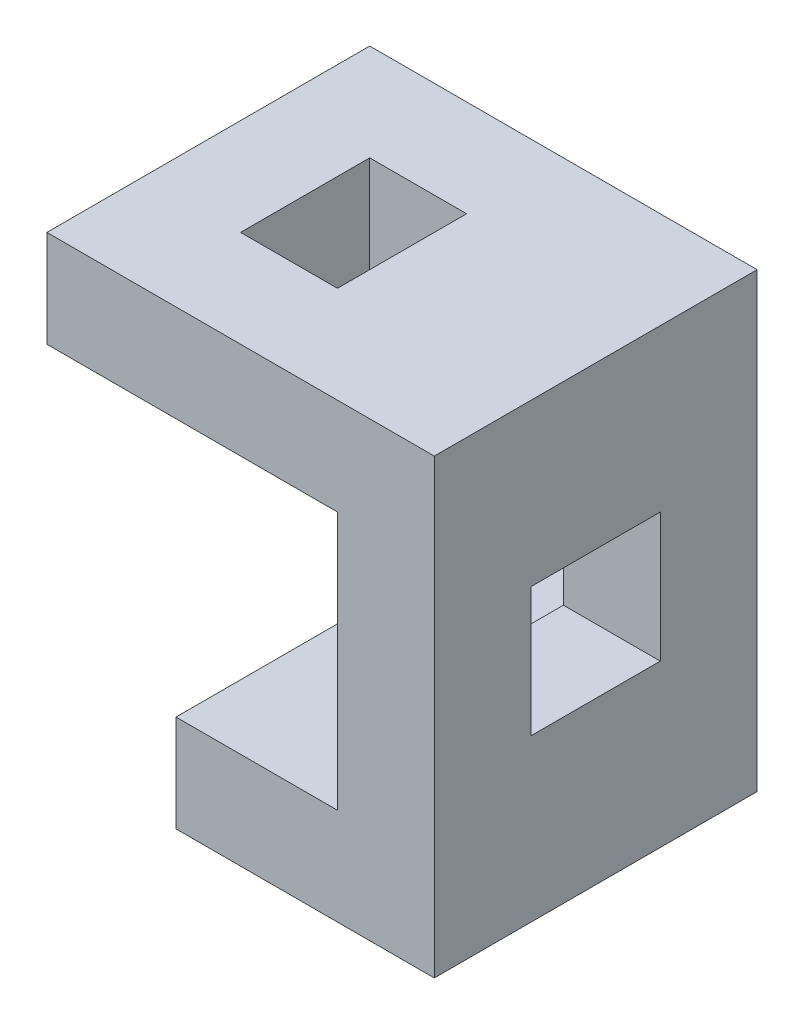
from build123d import *

# Parameters (mm, degrees)
BOSS_EXTRUDE1_DEPTH = 50
SKETCH2_W           = 20
SKETCH2_H           = 20
CUT_EXTRUDE1_DEPTH  = 50
SKETCH6_W           = 15
SKETCH6_H           = 20
CUT_EXTRUDE2_DEPTH  = 50


with BuildPart() as part:
    # Sketch1 → Boss-Extrude1 (new body)
    with BuildSketch(Plane.XY):
        Polygon((-60, 70), (0, 70), (0, 0), (-40, 0), (-40, 15), (-15, 15), (-15, 55), (-60, 55), align=None)
    extrude(amount=BOSS_EXTRUDE1_DEPTH)

    # Sketch2 → Cut-Extrude1 (cut)
    with BuildSketch(Plane(origin=(0, 0, 0), x_dir=(0, 0, -1), z_dir=(1, 0, 0))):
        with Locations((-25, 35)):
            Rectangle(SKETCH2_W, SKETCH2_H)
    extrude(amount=-CUT_EXTRUDE1_DEPTH, mode=Mode.SUBTRACT)

    # Sketch6 → Cut-Extrude2 (cut)
    with BuildSketch(Plane(origin=(0, 70, 0), x_dir=(1, 0, 0), z_dir=(0, 1, 0))):
        with Locations((-37.5, -25)):
            Rectangle(SKETCH6_W, SKETCH6_H)
    extrude(amount=-CUT_EXTRUDE2_DEPTH, mode=Mode.SUBTRACT)


solid = part.part
